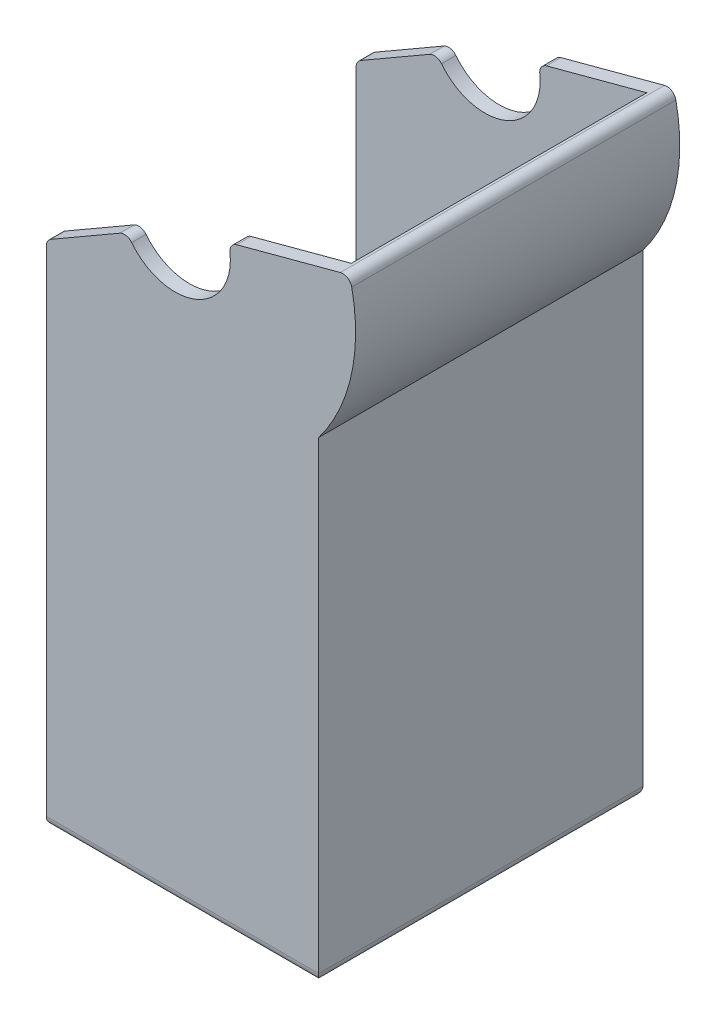
from build123d import *

# Parameters (mm, degrees)
SKETCH1_R               = 49
BOSS_EXTRUDE1_DEPTH     = 88
CUT_EXTRUDE1_DEPTH      = 88
SKETCH3_W               = 77.94
SKETCH3_H               = 128.535806693
BOSS_EXTRUDE2_DEPTH     = 88
CUT_EXTRUDE2_DEPTH      = 40.1
CUT_EXTRUDE2_DEPTH_BACK = 40.1
SKETCH4_R               = 45.5
CUT_EXTRUDE3_DEPTH      = 40.1
CUT_EXTRUDE3_DEPTH_BACK = 40.1
SKETCH5_W               = 69.94
SKETCH5_H               = 158.24
CUT_EXTRUDE5_DEPTH      = 202.302306246
CUT_EXTRUDE5_DEPTH_BACK = 4
SKETCH6_W               = 88
SKETCH6_H               = 170.045451323
SKETCH7_R               = 15
CUT_EXTRUDE6_DEPTH      = 188.576378044
FILLET1_R               = 2.5


with BuildPart() as part:
    # Sketch1 → Boss-Extrude1 (new body)
    with BuildSketch(Plane.XY):
        Circle(SKETCH1_R)
    extrude(amount=BOSS_EXTRUDE1_DEPTH)

    # Sketch2 → Cut-Extrude1 (cut)
    with BuildSketch(Plane(origin=(0, 0, 0), x_dir=(-1, 0, 0), z_dir=(0, 0, -1))):
        with BuildLine():
            Line((0, 0), (-47.330365488, 12.68213321))
            ThreePointArc((-47.330365488, 12.68213321), (18.751488186, 45.270097093), (42.435244785, -24.5))
            Line((42.435244785, -24.5), (0, 0))
        make_face()
    extrude(amount=-CUT_EXTRUDE1_DEPTH, mode=Mode.SUBTRACT)

    # Sketch3 → Boss-Extrude2 (add)
    with BuildSketch(Plane(origin=(0, 0, 0), x_dir=(-1, 0, 0), z_dir=(0, 0, -1))):
        with Locations((0, -93.972096654)):
            Rectangle(SKETCH3_W, SKETCH3_H)
    extrude(amount=-BOSS_EXTRUDE2_DEPTH)

    # Sketch4 → Cut-Extrude2 (cut, two sides: drawn at the far end of the back side and taken through both)
    with BuildSketch(Plane(origin=(0, 0, 44), x_dir=(-1, 0, 0), z_dir=(0, 0, -1)).offset(-CUT_EXTRUDE2_DEPTH_BACK)):
        Circle(SKETCH4_R)
    extrude(amount=CUT_EXTRUDE2_DEPTH + CUT_EXTRUDE2_DEPTH_BACK, mode=Mode.SUBTRACT)

    # Sketch5 → Cut-Extrude3 (cut, two sides: drawn at the far end of the back side and taken through both)
    with BuildSketch(Plane(origin=(0, 0, 44), x_dir=(-1, 0, 0), z_dir=(0, 0, -1)).offset(-CUT_EXTRUDE3_DEPTH_BACK)):
        with Locations((0, -79.12)):
            Rectangle(SKETCH5_W, SKETCH5_H)
    extrude(amount=CUT_EXTRUDE3_DEPTH + CUT_EXTRUDE3_DEPTH_BACK, mode=Mode.SUBTRACT)

    # Sketch6 → Cut-Extrude5 (cut, two sides: drawn at the far end of the back side and taken through both)
    with BuildSketch(Plane.ZY.offset(38.97).offset(-CUT_EXTRUDE5_DEPTH_BACK)):
        with Locations((44, -73.246459109)):
            Rectangle(SKETCH6_W, SKETCH6_H)
    extrude(amount=CUT_EXTRUDE5_DEPTH + CUT_EXTRUDE5_DEPTH_BACK, mode=Mode.SUBTRACT)

    # Sketch7 → Cut-Extrude6 (cut, through all)
    with BuildSketch(Plane(origin=(0, 0, 0), x_dir=(-1, 0, 0), z_dir=(0, 0, -1))):
        Circle(SKETCH7_R)
    extrude(amount=-CUT_EXTRUDE6_DEPTH, mode=Mode.SUBTRACT)

    # Fillet1
    fillet1_edges = [part.edges().sort_by_distance(p)[0] for p in [
        (47.330365488, 12.68213321, 44),
        (14.488887394, 3.882285677, 86.05),
        (14.488887394, 3.882285677, 1.95),
        (-12.990381057, -7.5, 1.95),
        (-12.990381057, -7.5, 86.05),
        (2, -158.24, 0),
        (38.97, -158.24, 44),
        (2, -158.24, 88),
        (-34.97, -20.189938914, 1.95),
        (-34.97, -20.189938914, 86.05),
    ]]
    fillet(fillet1_edges, radius=FILLET1_R)


solid = part.part
